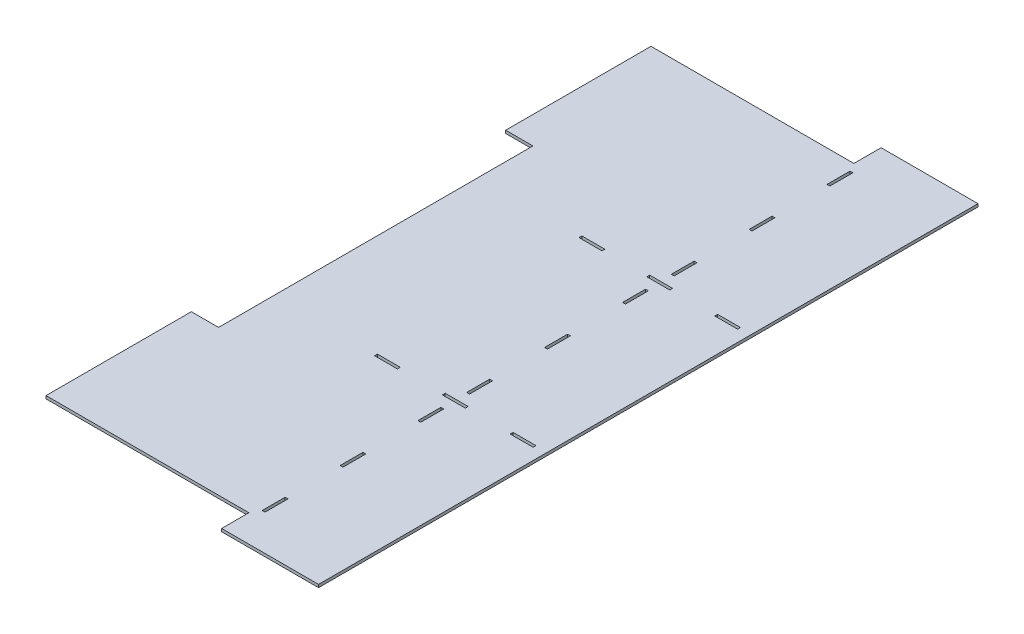
from build123d import *

# Parameters (mm, degrees)
SKETCH3_W           = 25.4
SKETCH3_H           = 3.175
SKETCH3_W_2         = 3.175
SKETCH3_H_2         = 25.4
BOSS_EXTRUDE1_DEPTH = 3.175
SKETCH6_W           = 107.287119944
SKETCH6_H           = 30.1625
SKETCH6_W_2         = 30.1625
SKETCH6_H_2         = 160.930679916
BOSS_EXTRUDE2_DEPTH = 3.175


with BuildPart() as part:
    # Sketch3 → Boss-Extrude1 (new body)
    with BuildSketch(Plane(origin=(0, 0, 0), x_dir=(1, 0, 0), z_dir=(0, 1, 0))):
        Polygon((0, 0), (200.98004, 0), (200.98004, 669.93516), (0, 669.93516), (-100.8126, 669.93516), (-100.8126, 0), align=None)
        with Locations((25.4, 448.21094)):
            Rectangle(SKETCH3_W, SKETCH3_H, mode=Mode.SUBTRACT)
        with Locations((175.58004, 448.21094)):
            Rectangle(SKETCH3_W, SKETCH3_H, mode=Mode.SUBTRACT)
        with Locations((100.49002, 448.21094)):
            Rectangle(SKETCH3_W, SKETCH3_H, mode=Mode.SUBTRACT)
        with Locations((100.49002, 647.71016)):
            Rectangle(SKETCH3_W_2, SKETCH3_H_2, mode=Mode.SUBTRACT)
        with Locations((100.49002, 475.19844)):
            Rectangle(SKETCH3_W_2, SKETCH3_H_2, mode=Mode.SUBTRACT)
        with Locations((100.49002, 561.4543)):
            Rectangle(SKETCH3_W_2, SKETCH3_H_2, mode=Mode.SUBTRACT)
        with Locations((100.49002, 421.22344)):
            Rectangle(SKETCH3_W_2, SKETCH3_H_2, mode=Mode.SUBTRACT)
        with Locations((100.49002, 334.96758)):
            Rectangle(SKETCH3_W_2, SKETCH3_H_2, mode=Mode.SUBTRACT)
        with Locations((100.49002, 248.71172)):
            Rectangle(SKETCH3_W_2, SKETCH3_H_2, mode=Mode.SUBTRACT)
        with Locations((25.4, 221.72422)):
            Rectangle(SKETCH3_W, SKETCH3_H, mode=Mode.SUBTRACT)
        with Locations((100.49002, 221.72422)):
            Rectangle(SKETCH3_W, SKETCH3_H, mode=Mode.SUBTRACT)
        with Locations((175.58004, 221.72422)):
            Rectangle(SKETCH3_W, SKETCH3_H, mode=Mode.SUBTRACT)
        with Locations((100.49002, 22.225)):
            Rectangle(SKETCH3_W_2, SKETCH3_H_2, mode=Mode.SUBTRACT)
        with Locations((100.49002, 108.48086)):
            Rectangle(SKETCH3_W_2, SKETCH3_H_2, mode=Mode.SUBTRACT)
        with Locations((100.49002, 194.73672)):
            Rectangle(SKETCH3_W_2, SKETCH3_H_2, mode=Mode.SUBTRACT)
    extrude(amount=BOSS_EXTRUDE1_DEPTH)

    # Sketch6 → Boss-Extrude2 (add)
    with BuildSketch(Plane(origin=(0, 3.175, 0), x_dir=(1, 0, 0), z_dir=(0, 1, 0))):
        with Locations((147.336480028, -15.08125)):
            Rectangle(SKETCH6_W, SKETCH6_H)
        with Locations((147.336480028, 685.01641)):
            Rectangle(SKETCH6_W, SKETCH6_H)
        with Locations((-115.89385, 589.469820042)):
            Rectangle(SKETCH6_W_2, SKETCH6_H_2)
        with Locations((-115.89385, 80.465339958)):
            Rectangle(SKETCH6_W_2, SKETCH6_H_2)
    extrude(amount=-BOSS_EXTRUDE2_DEPTH)


solid = part.part
